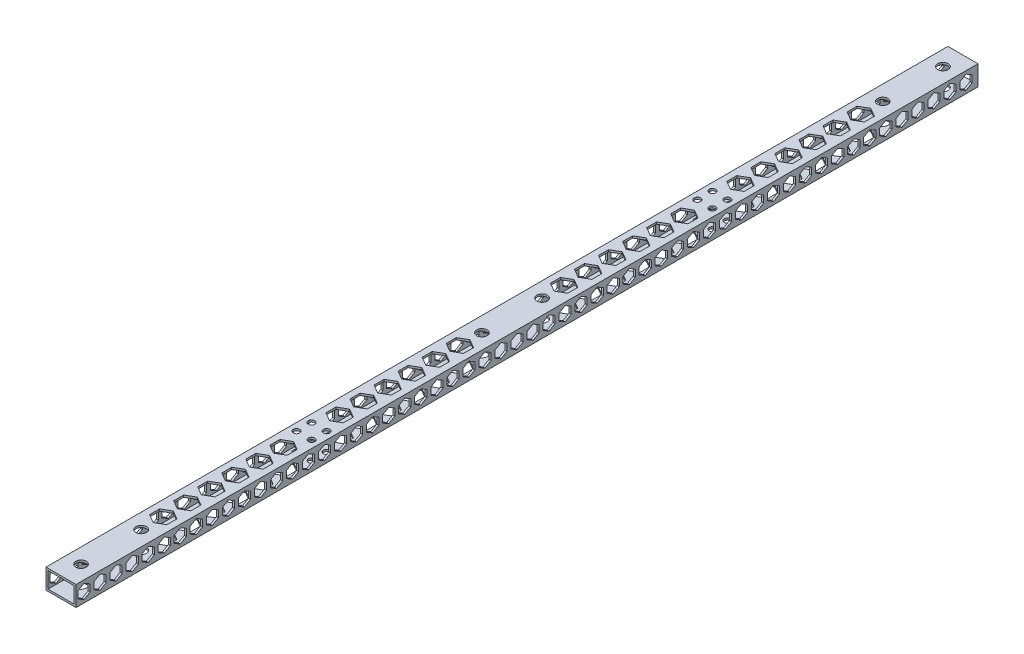
from build123d import *

# Parameters (mm, degrees)
SKETCH_1_W          = 15
SKETCH_1_H          = 10
SKETCH_1_W_2        = 13
SKETCH_1_H_2        = 8
EXTRUDE_1_DEPTH     = 450
SKETCH_2_R          = 2.6
SKETCH_2_R_2        = 1.6
CUT_EXTRUDE_1_DEPTH = 451.360966337
CUT_EXTRUDE_2_DEPTH = 451.360966337


with BuildPart() as part:
    # 草图1 → 拉伸-薄壁1 (new body)
    with BuildSketch(Plane.XY):
        with Locations((7.5, -5)):
            Rectangle(SKETCH_1_W, SKETCH_1_H)
        with Locations((7.5, -5)):
            Rectangle(SKETCH_1_W_2, SKETCH_1_H_2, mode=Mode.SUBTRACT)
    extrude(amount=EXTRUDE_1_DEPTH)

    # 草图2 → 切除-拉伸1 (cut, through all)
    with BuildSketch(Plane.XZ.offset(10)):
        with Locations(Location((7.5, 240, 0), (0, 0, 270))):
            Circle(SKETCH_2_R)
        with Locations(Location((7.5, 210, 0), (0, 0, 270))):
            Circle(SKETCH_2_R)
        with Locations(Location((7.5, 440, 0), (0, 0, 270))):
            Circle(SKETCH_2_R)
        with Locations(Location((7.5, 410, 0), (0, 0, 270))):
            Circle(SKETCH_2_R)
        with Locations(Location((7.5, 40, 0), (0, 0, 270))):
            Circle(SKETCH_2_R)
        with Locations(Location((7.5, 10, 0), (0, 0, 270))):
            Circle(SKETCH_2_R)
        with Locations(Location((3.75, 328.75, 0), (0, 0, 270))):
            Circle(SKETCH_2_R_2)
        with Locations(Location((11.25, 328.75, 0), (0, 0, 270))):
            Circle(SKETCH_2_R_2)
        with Locations(Location((11.25, 321.25, 0), (0, 0, 270))):
            Circle(SKETCH_2_R_2)
        with Locations(Location((3.75, 321.25, 0), (0, 0, 270))):
            Circle(SKETCH_2_R_2)
        with Locations(Location((3.75, 128.75, 0), (0, 0, 270))):
            Circle(SKETCH_2_R_2)
        with Locations(Location((11.25, 128.75, 0), (0, 0, 270))):
            Circle(SKETCH_2_R_2)
        with Locations(Location((11.25, 121.25, 0), (0, 0, 270))):
            Circle(SKETCH_2_R_2)
        with Locations(Location((3.75, 121.25, 0), (0, 0, 270))):
            Circle(SKETCH_2_R_2)
        Polygon((7.5, 392), (3.169872981, 389.5), (3.169872981, 384.5), (7.5, 382), (11.830127019, 384.5), (11.830127019, 389.5), align=None)
        Polygon((3.169872981, 401.5), (3.169872981, 396.5), (7.5, 394), (11.830127019, 396.5), (11.830127019, 401.5), (7.5, 404), align=None)
        Polygon((7.5, 380), (3.169872981, 377.5), (3.169872981, 372.5), (7.5, 370), (11.830127019, 372.5), (11.830127019, 377.5), align=None)
        Polygon((7.5, 368), (3.169872981, 365.5), (3.169872981, 360.5), (7.5, 358), (11.830127019, 360.5), (11.830127019, 365.5), align=None)
        Polygon((7.5, 356), (3.169872981, 353.5), (3.169872981, 348.5), (7.5, 346), (11.830127019, 348.5), (11.830127019, 353.5), align=None)
        Polygon((7.5, 344), (3.169872981, 341.5), (3.169872981, 336.5), (7.5, 334), (11.830127019, 336.5), (11.830127019, 341.5), align=None)
        Polygon((7.5, 316), (11.830127019, 313.5), (11.830127019, 308.5), (7.5, 306), (3.169872981, 308.5), (3.169872981, 313.5), align=None)
        Polygon((7.5, 304), (11.830127019, 301.5), (11.830127019, 296.5), (7.5, 294), (3.169872981, 296.5), (3.169872981, 301.5), align=None)
        Polygon((7.5, 292), (11.830127019, 289.5), (11.830127019, 284.5), (7.5, 282), (3.169872981, 284.5), (3.169872981, 289.5), align=None)
        Polygon((7.5, 280), (11.830127019, 277.5), (11.830127019, 272.5), (7.5, 270), (3.169872981, 272.5), (3.169872981, 277.5), align=None)
        Polygon((7.5, 268), (11.830127019, 265.5), (11.830127019, 260.5), (7.5, 258), (3.169872981, 260.5), (3.169872981, 265.5), align=None)
        Polygon((7.5, 246), (3.169872981, 248.5), (3.169872981, 253.5), (7.5, 256), (11.830127019, 253.5), (11.830127019, 248.5), align=None)
        Polygon((7.5, 192), (3.169872981, 189.5), (3.169872981, 184.5), (7.5, 182), (11.830127019, 184.5), (11.830127019, 189.5), align=None)
        Polygon((3.169872981, 201.5), (3.169872981, 196.5), (7.5, 194), (11.830127019, 196.5), (11.830127019, 201.5), (7.5, 204), align=None)
        Polygon((7.5, 180), (3.169872981, 177.5), (3.169872981, 172.5), (7.5, 170), (11.830127019, 172.5), (11.830127019, 177.5), align=None)
        Polygon((7.5, 168), (3.169872981, 165.5), (3.169872981, 160.5), (7.5, 158), (11.830127019, 160.5), (11.830127019, 165.5), align=None)
        Polygon((7.5, 156), (3.169872981, 153.5), (3.169872981, 148.5), (7.5, 146), (11.830127019, 148.5), (11.830127019, 153.5), align=None)
        Polygon((7.5, 144), (3.169872981, 141.5), (3.169872981, 136.5), (7.5, 134), (11.830127019, 136.5), (11.830127019, 141.5), align=None)
        Polygon((7.5, 116), (11.830127019, 113.5), (11.830127019, 108.5), (7.5, 106), (3.169872981, 108.5), (3.169872981, 113.5), align=None)
        Polygon((7.5, 104), (11.830127019, 101.5), (11.830127019, 96.5), (7.5, 94), (3.169872981, 96.5), (3.169872981, 101.5), align=None)
        Polygon((7.5, 92), (11.830127019, 89.5), (11.830127019, 84.5), (7.5, 82), (3.169872981, 84.5), (3.169872981, 89.5), align=None)
        Polygon((7.5, 80), (11.830127019, 77.5), (11.830127019, 72.5), (7.5, 70), (3.169872981, 72.5), (3.169872981, 77.5), align=None)
        Polygon((7.5, 68), (11.830127019, 65.5), (11.830127019, 60.5), (7.5, 58), (3.169872981, 60.5), (3.169872981, 65.5), align=None)
        Polygon((7.5, 46), (3.169872981, 48.5), (3.169872981, 53.5), (7.5, 56), (11.830127019, 53.5), (11.830127019, 48.5), align=None)
    extrude(amount=-CUT_EXTRUDE_1_DEPTH, mode=Mode.SUBTRACT)

    # 草图3 → 切除-拉伸2 (cut, through all)
    with BuildSketch(Plane.ZY):
        Polygon((9.031088913, -6.75), (9.031088913, -3.25), (6, -1.5), (2.968911087, -3.25), (2.968911087, -6.75), (6, -8.5), align=None)
        Polygon((14, -1.5), (10.968911087, -3.25), (10.968911087, -6.75), (14, -8.5), (17.031088913, -6.75), (17.031088913, -3.25), align=None)
        Polygon((22, -1.5), (18.968911087, -3.25), (18.968911087, -6.75), (22, -8.5), (25.031088913, -6.75), (25.031088913, -3.25), align=None)
        Polygon((30, -1.5), (26.968911087, -3.25), (26.968911087, -6.75), (30, -8.5), (33.031088913, -6.75), (33.031088913, -3.25), align=None)
        Polygon((38, -1.5), (34.968911087, -3.25), (34.968911087, -6.75), (38, -8.5), (41.031088913, -6.75), (41.031088913, -3.25), align=None)
        Polygon((46, -1.5), (42.968911087, -3.25), (42.968911087, -6.75), (46, -8.5), (49.031088913, -6.75), (49.031088913, -3.25), align=None)
        Polygon((54, -1.5), (50.968911087, -3.25), (50.968911087, -6.75), (54, -8.5), (57.031088913, -6.75), (57.031088913, -3.25), align=None)
        Polygon((62, -1.5), (58.968911087, -3.25), (58.968911087, -6.75), (62, -8.5), (65.031088913, -6.75), (65.031088913, -3.25), align=None)
        Polygon((70, -1.5), (66.968911087, -3.25), (66.968911087, -6.75), (70, -8.5), (73.031088913, -6.75), (73.031088913, -3.25), align=None)
        Polygon((78, -1.5), (74.968911087, -3.25), (74.968911087, -6.75), (78, -8.5), (81.031088913, -6.75), (81.031088913, -3.25), align=None)
        Polygon((86, -1.5), (82.968911087, -3.25), (82.968911087, -6.75), (86, -8.5), (89.031088913, -6.75), (89.031088913, -3.25), align=None)
        Polygon((94, -1.5), (90.968911087, -3.25), (90.968911087, -6.75), (94, -8.5), (97.031088913, -6.75), (97.031088913, -3.25), align=None)
        Polygon((102, -1.5), (98.968911087, -3.25), (98.968911087, -6.75), (102, -8.5), (105.031088913, -6.75), (105.031088913, -3.25), align=None)
        Polygon((110, -1.5), (106.968911087, -3.25), (106.968911087, -6.75), (110, -8.5), (113.031088913, -6.75), (113.031088913, -3.25), align=None)
        Polygon((118, -1.5), (114.968911087, -3.25), (114.968911087, -6.75), (118, -8.5), (121.031088913, -6.75), (121.031088913, -3.25), align=None)
        Polygon((126, -1.5), (122.968911087, -3.25), (122.968911087, -6.75), (126, -8.5), (129.031088913, -6.75), (129.031088913, -3.25), align=None)
        Polygon((134, -1.5), (130.968911087, -3.25), (130.968911087, -6.75), (134, -8.5), (137.031088913, -6.75), (137.031088913, -3.25), align=None)
        Polygon((142, -1.5), (138.968911087, -3.25), (138.968911087, -6.75), (142, -8.5), (145.031088913, -6.75), (145.031088913, -3.25), align=None)
        Polygon((150, -1.5), (146.968911087, -3.25), (146.968911087, -6.75), (150, -8.5), (153.031088913, -6.75), (153.031088913, -3.25), align=None)
        Polygon((158, -1.5), (154.968911087, -3.25), (154.968911087, -6.75), (158, -8.5), (161.031088913, -6.75), (161.031088913, -3.25), align=None)
        Polygon((166, -1.5), (162.968911087, -3.25), (162.968911087, -6.75), (166, -8.5), (169.031088913, -6.75), (169.031088913, -3.25), align=None)
        Polygon((174, -1.5), (170.968911087, -3.25), (170.968911087, -6.75), (174, -8.5), (177.031088913, -6.75), (177.031088913, -3.25), align=None)
        Polygon((182, -1.5), (178.968911087, -3.25), (178.968911087, -6.75), (182, -8.5), (185.031088913, -6.75), (185.031088913, -3.25), align=None)
        Polygon((190, -1.5), (186.968911087, -3.25), (186.968911087, -6.75), (190, -8.5), (193.031088913, -6.75), (193.031088913, -3.25), align=None)
        Polygon((198, -1.5), (194.968911087, -3.25), (194.968911087, -6.75), (198, -8.5), (201.031088913, -6.75), (201.031088913, -3.25), align=None)
        Polygon((206, -1.5), (202.968911087, -3.25), (202.968911087, -6.75), (206, -8.5), (209.031088913, -6.75), (209.031088913, -3.25), align=None)
        Polygon((214, -1.5), (210.968911087, -3.25), (210.968911087, -6.75), (214, -8.5), (217.031088913, -6.75), (217.031088913, -3.25), align=None)
        Polygon((222, -1.5), (218.968911087, -3.25), (218.968911087, -6.75), (222, -8.5), (225.031088913, -6.75), (225.031088913, -3.25), align=None)
        Polygon((230, -1.5), (226.968911087, -3.25), (226.968911087, -6.75), (230, -8.5), (233.031088913, -6.75), (233.031088913, -3.25), align=None)
        Polygon((238, -1.5), (234.968911087, -3.25), (234.968911087, -6.75), (238, -8.5), (241.031088913, -6.75), (241.031088913, -3.25), align=None)
        Polygon((246, -1.5), (242.968911087, -3.25), (242.968911087, -6.75), (246, -8.5), (249.031088913, -6.75), (249.031088913, -3.25), align=None)
        Polygon((254, -1.5), (250.968911087, -3.25), (250.968911087, -6.75), (254, -8.5), (257.031088913, -6.75), (257.031088913, -3.25), align=None)
        Polygon((262, -1.5), (258.968911087, -3.25), (258.968911087, -6.75), (262, -8.5), (265.031088913, -6.75), (265.031088913, -3.25), align=None)
        Polygon((270, -1.5), (266.968911087, -3.25), (266.968911087, -6.75), (270, -8.5), (273.031088913, -6.75), (273.031088913, -3.25), align=None)
        Polygon((278, -1.5), (274.968911087, -3.25), (274.968911087, -6.75), (278, -8.5), (281.031088913, -6.75), (281.031088913, -3.25), align=None)
        Polygon((286, -1.5), (282.968911087, -3.25), (282.968911087, -6.75), (286, -8.5), (289.031088913, -6.75), (289.031088913, -3.25), align=None)
        Polygon((294, -1.5), (290.968911087, -3.25), (290.968911087, -6.75), (294, -8.5), (297.031088913, -6.75), (297.031088913, -3.25), align=None)
        Polygon((302, -1.5), (298.968911087, -3.25), (298.968911087, -6.75), (302, -8.5), (305.031088913, -6.75), (305.031088913, -3.25), align=None)
        Polygon((310, -1.5), (306.968911087, -3.25), (306.968911087, -6.75), (310, -8.5), (313.031088913, -6.75), (313.031088913, -3.25), align=None)
        Polygon((318, -1.5), (314.968911087, -3.25), (314.968911087, -6.75), (318, -8.5), (321.031088913, -6.75), (321.031088913, -3.25), align=None)
        Polygon((326, -1.5), (322.968911087, -3.25), (322.968911087, -6.75), (326, -8.5), (329.031088913, -6.75), (329.031088913, -3.25), align=None)
        Polygon((334, -1.5), (330.968911087, -3.25), (330.968911087, -6.75), (334, -8.5), (337.031088913, -6.75), (337.031088913, -3.25), align=None)
        Polygon((342, -1.5), (338.968911087, -3.25), (338.968911087, -6.75), (342, -8.5), (345.031088913, -6.75), (345.031088913, -3.25), align=None)
        Polygon((350, -1.5), (346.968911087, -3.25), (346.968911087, -6.75), (350, -8.5), (353.031088913, -6.75), (353.031088913, -3.25), align=None)
        Polygon((358, -1.5), (354.968911087, -3.25), (354.968911087, -6.75), (358, -8.5), (361.031088913, -6.75), (361.031088913, -3.25), align=None)
        Polygon((366, -1.5), (362.968911087, -3.25), (362.968911087, -6.75), (366, -8.5), (369.031088913, -6.75), (369.031088913, -3.25), align=None)
        Polygon((374, -1.5), (370.968911087, -3.25), (370.968911087, -6.75), (374, -8.5), (377.031088913, -6.75), (377.031088913, -3.25), align=None)
        Polygon((382, -1.5), (378.968911087, -3.25), (378.968911087, -6.75), (382, -8.5), (385.031088913, -6.75), (385.031088913, -3.25), align=None)
        Polygon((390, -1.5), (386.968911087, -3.25), (386.968911087, -6.75), (390, -8.5), (393.031088913, -6.75), (393.031088913, -3.25), align=None)
        Polygon((398, -1.5), (394.968911087, -3.25), (394.968911087, -6.75), (398, -8.5), (401.031088913, -6.75), (401.031088913, -3.25), align=None)
        Polygon((406, -1.5), (402.968911087, -3.25), (402.968911087, -6.75), (406, -8.5), (409.031088913, -6.75), (409.031088913, -3.25), align=None)
        Polygon((414, -1.5), (410.968911087, -3.25), (410.968911087, -6.75), (414, -8.5), (417.031088913, -6.75), (417.031088913, -3.25), align=None)
        Polygon((422, -1.5), (418.968911087, -3.25), (418.968911087, -6.75), (422, -8.5), (425.031088913, -6.75), (425.031088913, -3.25), align=None)
        Polygon((430, -1.5), (426.968911087, -3.25), (426.968911087, -6.75), (430, -8.5), (433.031088913, -6.75), (433.031088913, -3.25), align=None)
        Polygon((438, -1.5), (434.968911087, -3.25), (434.968911087, -6.75), (438, -8.5), (441.031088913, -6.75), (441.031088913, -3.25), align=None)
        Polygon((446, -1.5), (442.968911087, -3.25), (442.968911087, -6.75), (446, -8.5), (449.031088913, -6.75), (449.031088913, -3.25), align=None)
    extrude(amount=-CUT_EXTRUDE_2_DEPTH, mode=Mode.SUBTRACT)


solid = part.part
